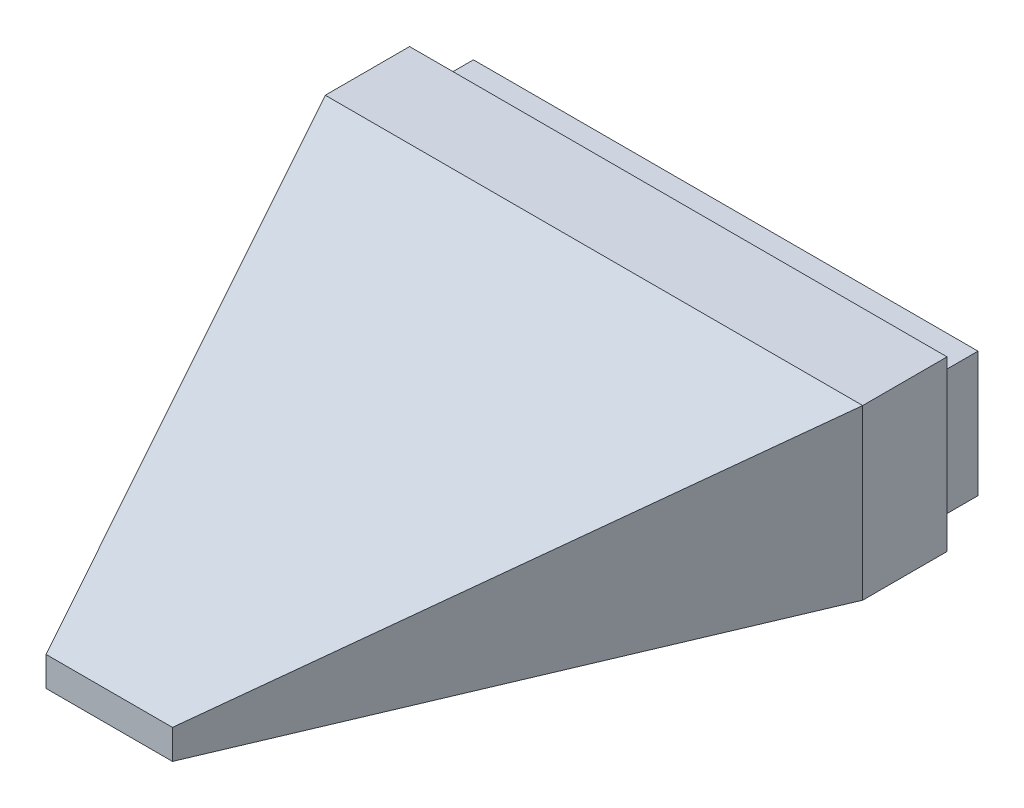
from build123d import *

# Parameters (mm, degrees)
CROQUIS1_W              = 127.5
CROQUIS1_H              = 40
SALIENTE_EXTRUIR2_DEPTH = 135
CROQUIS3_W              = 119.7
CROQUIS3_H              = 29.7
SALIENTE_EXTRUIR3_DEPTH = 10
CORTAR_EXTRUIR1_DEPTH   = 184
CORTAR_EXTRUIR2_DEPTH   = 184
VACIADO1_T              = -5


with BuildPart() as part:
    # Croquis1 → Saliente-Extruir2 (new body)
    with BuildSketch(Plane.XY):
        Rectangle(CROQUIS1_W, CROQUIS1_H)
    extrude(amount=SALIENTE_EXTRUIR2_DEPTH)

    # Croquis3 → Saliente-Extruir3 (add)
    with BuildSketch(Plane(origin=(0, 0, 0), x_dir=(-1, 0, 0), z_dir=(0, 0, -1))):
        with Locations((-1.25, 0)):
            Rectangle(CROQUIS3_W, CROQUIS3_H)
    extrude(amount=SALIENTE_EXTRUIR3_DEPTH)

    # Croquis4 → Cortar-Extruir1 (cut)
    with BuildSketch(Plane.ZY.offset(63.75)):
        Polygon((135, 20), (20, 20), (135, -13), align=None)
    extrude(amount=-CORTAR_EXTRUIR1_DEPTH, mode=Mode.SUBTRACT)

    # Croquis5 → Cortar-Extruir2 (cut)
    with BuildSketch(Plane(origin=(0, 20, 0), x_dir=(1, 0, 0), z_dir=(0, 1, 0))):
        Polygon((-63.75, -20), (-15, -135), (15, -135), (63.75, -20), (107.189901301, -122.473613325), (58.694004086, -179.25211437), (-87.283869917, -146.849702978), align=None)
    extrude(amount=-CORTAR_EXTRUIR2_DEPTH, mode=Mode.SUBTRACT)

    # Vaciado1
    vaciado1_openings = [part.faces().sort_by_distance(p)[0] for p in [
        (0, -20, 53.411416263),
    ]]
    offset(amount=VACIADO1_T, openings=vaciado1_openings, kind=Kind.INTERSECTION)


solid = part.part
